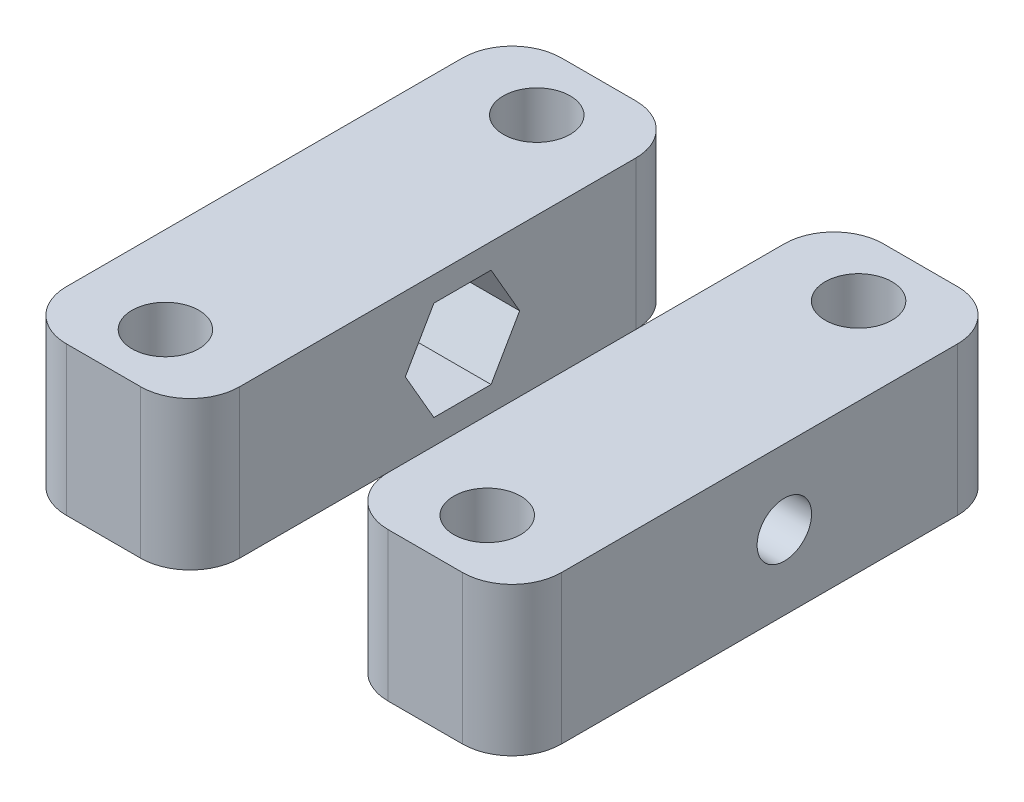
from build123d import *

# Parameters (mm, degrees)
SKETCH_1_W          = 20
SKETCH_1_H          = 20
SKETCH_1_R          = 1.35
EXTRUDE_1_DEPTH     = 6
SKETCH_2_W          = 6
SKETCH_2_H          = 20
CUT_EXTRUDE_1_DEPTH = 16.362291496
SKETCH_5_R          = 1.1
CUT_EXTRUDE_2_DEPTH = 24.151673806
CUT_EXTRUDE_4_DEPTH = 3
CUT_EXTRUDE_5_DEPTH = 3
FILLET_1_R          = 2
FILLET_2_R          = 2


with BuildPart() as part:
    # 草图1 → 凸台-拉伸1 (new body)
    with BuildSketch(Plane(origin=(0, 0, 0), x_dir=(1, 0, 0), z_dir=(0, 1, 0))):
        Rectangle(SKETCH_1_W, SKETCH_1_H)
        with Locations(Location((-6.5, 7.5, 0), (0, 0, 270))):
            Circle(SKETCH_1_R, mode=Mode.SUBTRACT)
        with Locations(Location((6.5, 7.5, 0), (0, 0, 90))):
            Circle(SKETCH_1_R, mode=Mode.SUBTRACT)
        with Locations(Location((6.5, -7.5, 0), (0, 0, 270))):
            Circle(SKETCH_1_R, mode=Mode.SUBTRACT)
        with Locations(Location((-6.5, -7.5, 0), (0, 0, 90))):
            Circle(SKETCH_1_R, mode=Mode.SUBTRACT)
    extrude(amount=EXTRUDE_1_DEPTH)

    # 草图2 → 切除-拉伸1 (cut, through all)
    with BuildSketch(Plane(origin=(0, 6, 0), x_dir=(1, 0, 0), z_dir=(0, 1, 0))):
        Rectangle(SKETCH_2_W, SKETCH_2_H)
    extrude(amount=-CUT_EXTRUDE_1_DEPTH, mode=Mode.SUBTRACT)


with BuildPart() as cut_extrude_1_piece_1:
    # of the separate pieces the step leaves, piece 1, a body of its own (cut_extrude_1_pieces)
    add(part.part.solids().sort_by_distance((3, 0, 10))[0])


with BuildPart() as cut_extrude_1_piece_2:
    # of the separate pieces the step leaves, piece 2, a body of its own (cut_extrude_1_pieces)
    add(part.part.solids().sort_by_distance((-10, 0, 10))[0])


with BuildPart() as cut_extrude_2_tool:
    # 草图5 → 切除-拉伸2 (new, through all)
    with BuildSketch(Plane(origin=(10, 0, 0), x_dir=(0, 0, -1), z_dir=(1, 0, 0))):
        with Locations((1, 3)):
            Circle(SKETCH_5_R)
    extrude(amount=-CUT_EXTRUDE_2_DEPTH)


with BuildPart() as cut_extrude_1_piece_1_1:
    add(cut_extrude_1_piece_1.part)

    # 切除-拉伸2: cut by cut_extrude_2_tool
    add(cut_extrude_2_tool.part, mode=Mode.SUBTRACT)

    # 草图6 → 切除-拉伸4 (cut)
    with BuildSketch(Plane.ZY.offset(-3)):
        Polygon((0.154700538, 5), (-2.154700538, 5), (-3.309401077, 3), (-2.154700538, 1), (0.154700538, 1), (1.309401077, 3), align=None)
    extrude(amount=-CUT_EXTRUDE_4_DEPTH, mode=Mode.SUBTRACT)

    # 圆角1
    fillet_1_edges = [cut_extrude_1_piece_1_1.edges().sort_by_distance(p)[0] for p in [
        (3, 3, -10),
        (3, 3, 10),
        (10, 3, 10),
        (10, 3, -10),
    ]]
    fillet(fillet_1_edges, radius=FILLET_1_R)


with BuildPart() as cut_extrude_1_piece_2_1:
    add(cut_extrude_1_piece_2.part)

    # 切除-拉伸2: cut by cut_extrude_2_tool
    add(cut_extrude_2_tool.part, mode=Mode.SUBTRACT)

    # 草图7 → 切除-拉伸5 (cut)
    with BuildSketch(Plane(origin=(-3, 0, 0), x_dir=(0, 0, -1), z_dir=(1, 0, 0))):
        Polygon((2.154700538, 5), (-0.154700538, 5), (-1.309401077, 3), (-0.154700538, 1), (2.154700538, 1), (3.309401077, 3), align=None)
    extrude(amount=-CUT_EXTRUDE_5_DEPTH, mode=Mode.SUBTRACT)

    # 圆角2
    fillet_2_edges = [cut_extrude_1_piece_2_1.edges().sort_by_distance(p)[0] for p in [
        (-3, 3, 10),
        (-10, 3, 10),
        (-10, 3, -10),
        (-3, 3, -10),
    ]]
    fillet(fillet_2_edges, radius=FILLET_2_R)


solid = Compound([cut_extrude_1_piece_1_1.part, cut_extrude_1_piece_2_1.part])
